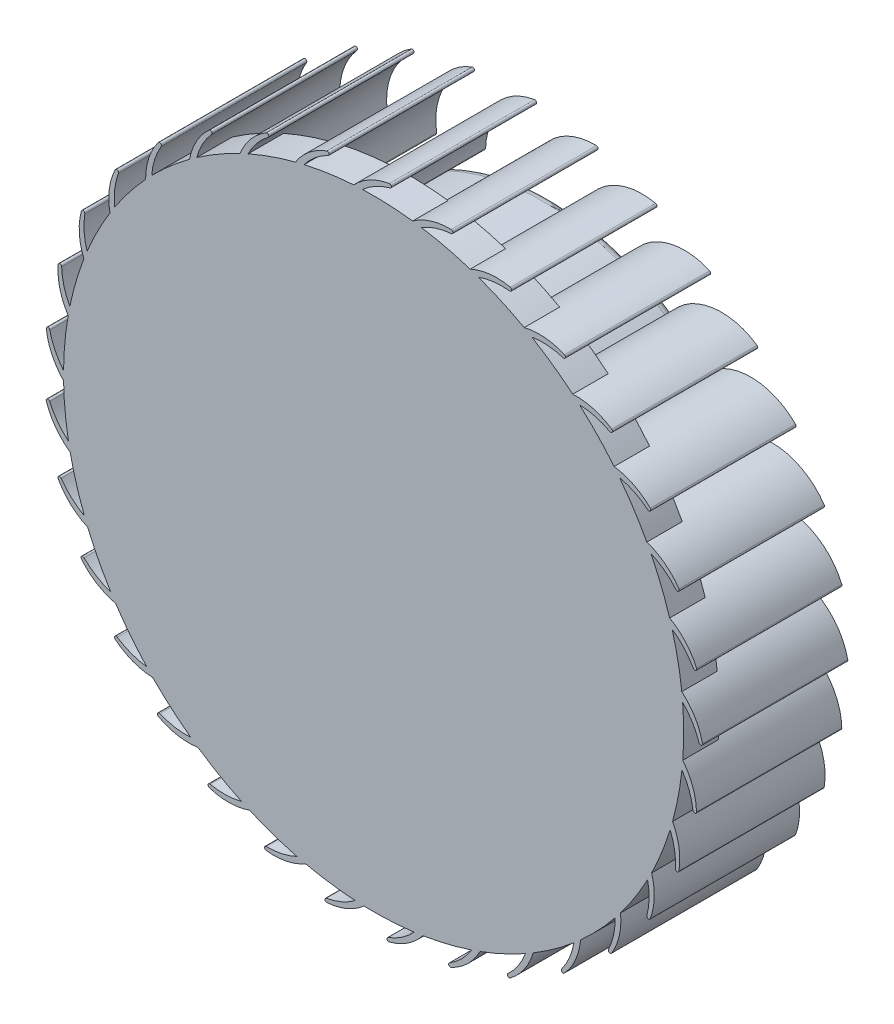
from build123d import *

# Parameters (mm, degrees)
BOSS_EXTRUDE1_REACH      = 28.072
FILLET1_R                = 0.1
CIRPATTERN1_COUNT        = 33
FILLET1_OF_CIRPATTERN1_R = 0.1
FILLET2_R                = 0.5


with BuildPart() as part:
    # Sketch1 → Revolve1 (revolve)
    with BuildSketch(Plane(origin=(0, 0, 0), x_dir=(1, 0, 0), z_dir=(0, 1, 0))):
        Polygon((0, 0), (17.5, 0), (17.5, 2), (12.5, 3.5), (12.5, 10), (0, 10), align=None)
    revolve(axis=Axis((0, 0, 0), (0, 0, -1)))

    # Boss-Extrude1: up to this face of the body (flat: up to its plane)
    boss_extrude1_end = Plane(part.part.faces().sort_by_distance((0, 0, 0))[0])
    # Sketch3 → Boss-Extrude1 (add, up to the picked face)
    with BuildSketch(Plane(origin=(0, 0, -8.2), x_dir=(-1, 0, 0), z_dir=(0, 0, -1)), mode=Mode.PRIVATE) as boss_extrude1_sk1:
        with BuildLine():
            ThreePointArc((-18.5, 1.951634214), (-16.428142987, 5.353268893), (-12.5, 4.69493566))
            ThreePointArc((-12.5, 4.69493566), (-16.288415666, 5.047664883), (-18.5, 1.951634214))
        make_face()
    boss_extrude1_tool1 = split(extrude(boss_extrude1_sk1.sketch, amount=-BOSS_EXTRUDE1_REACH, mode=Mode.PRIVATE), bisect_by=boss_extrude1_end, keep=Keep.BOTH, mode=Mode.PRIVATE)
    boss_extrude1 = boss_extrude1_tool1.solids().sort_by(Axis((16.317793, 5.111916, -8.2), (0, 0, 1)))[0]
    add(boss_extrude1)

    # Fillet1
    fillet1_edges = [part.edges().sort_by_distance(p)[0] for p in [
        (12.5, 4.69493566, -5.722107225),
        (18.5, 1.951634214, -4.1),
    ]]
    fillet(fillet1_edges, radius=FILLET1_R)

    # CirPattern1: Boss-Extrude1 ×33 about axis
    cirpattern1_axis = Axis((0, 0, 0), (0, 0, 1))
    for i in range(1, CIRPATTERN1_COUNT):
        add(boss_extrude1.rotate(cirpattern1_axis, i * 360 / CIRPATTERN1_COUNT))

    # Fillet1 of CirPattern1
    fillet1_of_cirpattern1_edges = [part.edges().sort_by_distance(p)[0] for p in [
        (11.3855863, 6.975732611, -5.722107225),
        (17.796331696, 5.417513662, -4.1),
        (9.859667846, 9.00440841, -5.722107225),
        (16.449457596, 8.687590051, -4.1),
        (7.977395307, 10.707641428, -5.722107225),
        (14.508057241, 11.6436743, -4.1),
        (5.806798917, 12.023872387, -5.722107225),
        (12.042297896, 14.178925823, -4.1),
        (3.426329685, 12.90552927, -5.722107225),
        (9.141298529, 16.201714024, -4.1),
        (0.92202397, 13.3207467, -5.722107225),
        (5.909908816, 17.638930066, -4.1),
        (-1.615606093, 13.254517637, -5.722107225),
        (2.464919601, 18.438629219, -4.1),
        (-4.094843942, 12.709235773, -5.722107225),
        (-1.069158232, 18.57190827, -4.1),
        (-6.426083463, 11.704609014, -5.722107225),
        (-4.5645939, 18.033950167, -4.1),
        (-8.525067584, 10.27694719, -5.722107225),
        (-7.895053252, 16.844198119, -4.1),
        (-10.31593355, 8.477849717, -5.722107225),
        (-10.940164808, 15.045652863, -4.1),
        (-11.733954801, 6.372340667, -5.722107225),
        (-13.589870305, 12.703318512, -4.1),
        (-12.727880352, 4.036518623, -5.722107225),
        (-15.74840248, 9.901853131, -4.1),
        (-13.261787145, 1.554806278, -5.722107225),
        (-17.337746358, 6.74250898, -4.1),
        (-13.316378398, -0.983100817, -5.722107225),
        (-18.300458909, 3.339472986, -4.1),
        (-12.88968104, -3.485476086, -5.722107225),
        (-18.601745194, -0.184260262, -4.1),
        (-11.997117025, -5.861877169, -5.722107225),
        (-18.230715941, -3.701333864, -4.1),
        (-10.670945943, -8.026414738, -5.722107225),
        (-17.200781115, -7.084631617, -4.1),
        (-8.959099071, -9.900856765, -5.722107225),
        (-15.549165243, -10.211872324, -4.1),
        (-6.923447017, -11.417456033, -5.722107225),
        (-13.335562025, -12.970029359, -4.1),
        (-4.637563548, -12.521398691, -5.722107225),
        (-10.639976851, -15.259415739, -4.1),
        (-2.18406645, -13.172785377, -5.722107225),
        (-7.559835192, -16.997287077, -4.1),
        (0.348368501, -13.348073278, -5.722107225),
        (-4.206461391, -18.120832174, -4.1),
        (2.868212506, -13.040927033, -5.722107225),
        (-0.701055116, -18.589443182, -4.1),
        (5.284391838, -12.262447706, -5.722107225),
        (2.829689117, -18.38618328, -4.1),
        (7.509579481, -11.040771571, -5.722107225),
        (6.258161013, -17.518398809, -4.1),
        (9.463351355, -9.420053184, -5.722107225),
        (9.460446665, -16.017453762, -4.1),
        (11.075093054, -7.458869531, -5.722107225),
        (12.320807125, -13.937596202, -4.1),
        (12.286552035, -5.2281029, -5.722107225),
        (14.735861514, -11.353997602, -4.1),
        (13.053943013, -2.808379008, -5.722107225),
        (16.618323474, -8.360035946, -4.1),
        (13.349530479, -0.287152982, -5.722107225),
        (17.900155925, -5.063920808, -4.1),
        (13.162631132, 2.244451502, -5.722107225),
        (18.535030103, -1.584782379, -4.1),
    ]]
    fillet(fillet1_of_cirpattern1_edges, radius=FILLET1_OF_CIRPATTERN1_R)

    # Fillet2
    fillet2_edges = [part.edges().sort_by_distance(p)[0] for p in [
        (-12.5, 0, -10),
    ]]
    fillet(fillet2_edges, radius=FILLET2_R)


solid = part.part
